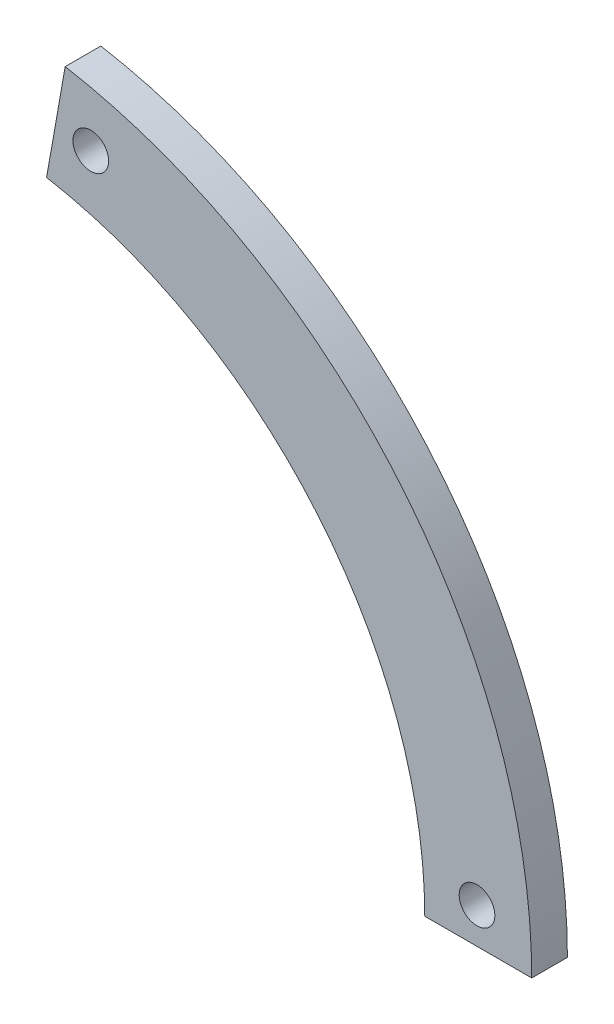
from build123d import *

# Parameters (mm, degrees)
CROQUIS1_R              = 1.5
SALIENTE_EXTRUIR1_DEPTH = 3


with BuildPart() as part:
    # Croquis1 → Saliente-Extruir1 (new body)
    with BuildSketch(Plane.XY):
        with BuildLine():
            Line((8.248288439, 46.778368268), (6.68545484, 37.915098491))
            ThreePointArc((6.68545484, 37.915098491), (29.49271106, 24.747322973), (38.5, 0))
            Line((38.5, 0), (47.5, 0))
            ThreePointArc((47.5, 0), (36.387111048, 30.53241146), (8.248288439, 46.778368268))
        make_face()
        with Locations((42.895221179, 3)):
            Circle(CROQUIS1_R, mode=Mode.SUBTRACT)
        with Locations((10.403100247, 41.722601851)):
            Circle(CROQUIS1_R, mode=Mode.SUBTRACT)
    extrude(amount=SALIENTE_EXTRUIR1_DEPTH)


solid = part.part
